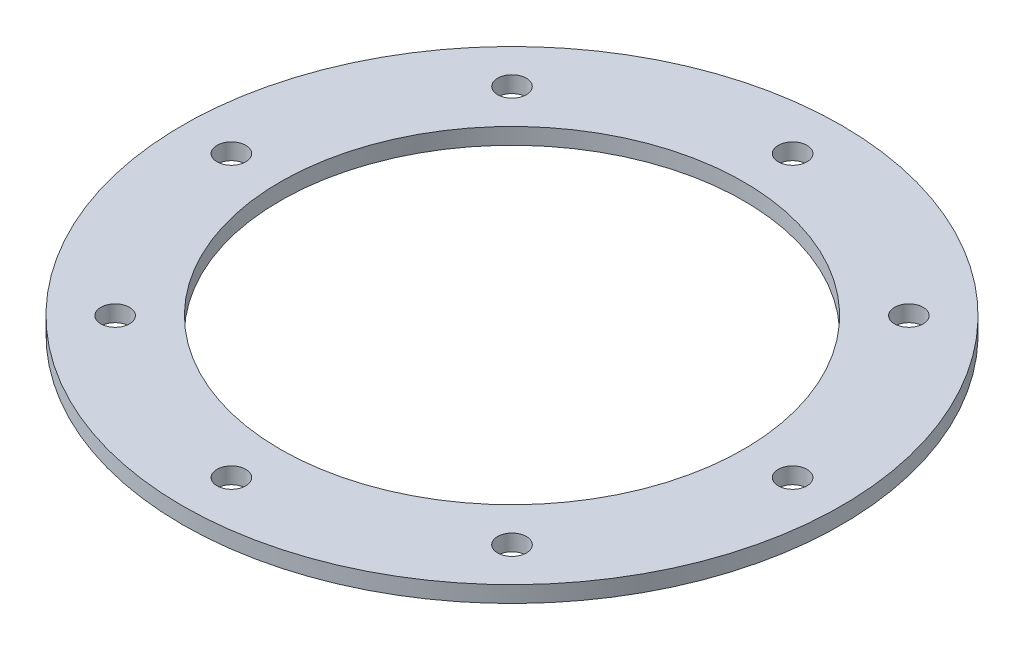
from build123d import *

# Parameters (mm, degrees)
SKETCH_1_R      = 101
SKETCH_1_R_2    = 71
SKETCH_1_R_3    = 4.4
EXTRUDE_1_DEPTH = 5


with BuildPart() as part:
    # Эскиз1 → Бобышка-Вытянуть1 (new body)
    with BuildSketch(Plane(origin=(0, 0, 0), x_dir=(1, 0, 0), z_dir=(0, 1, 0))):
        with Locations(Location((0, 0, 0), (0, 0, 270))):
            Circle(SKETCH_1_R)
        with Locations(Location((0, 0, 0), (0, 0, 270))):
            Circle(SKETCH_1_R_2, mode=Mode.SUBTRACT)
        with Locations(Location((86, 0, 0), (0, 0, 270))):
            Circle(SKETCH_1_R_3, mode=Mode.SUBTRACT)
        with Locations(Location((60.811183182, -60.811183182, 0), (0, 0, 270))):
            Circle(SKETCH_1_R_3, mode=Mode.SUBTRACT)
        with Locations(Location((0, -86, 0), (0, 0, 270))):
            Circle(SKETCH_1_R_3, mode=Mode.SUBTRACT)
        with Locations(Location((-60.811183182, -60.811183182, 0), (0, 0, 270))):
            Circle(SKETCH_1_R_3, mode=Mode.SUBTRACT)
        with Locations(Location((-86, 0, 0), (0, 0, 270))):
            Circle(SKETCH_1_R_3, mode=Mode.SUBTRACT)
        with Locations(Location((-60.811183182, 60.811183182, 0), (0, 0, 270))):
            Circle(SKETCH_1_R_3, mode=Mode.SUBTRACT)
        with Locations(Location((0, 86, 0), (0, 0, 270))):
            Circle(SKETCH_1_R_3, mode=Mode.SUBTRACT)
        with Locations(Location((60.811183182, 60.811183182, 0), (0, 0, 270))):
            Circle(SKETCH_1_R_3, mode=Mode.SUBTRACT)
    extrude(amount=EXTRUDE_1_DEPTH)


solid = part.part
